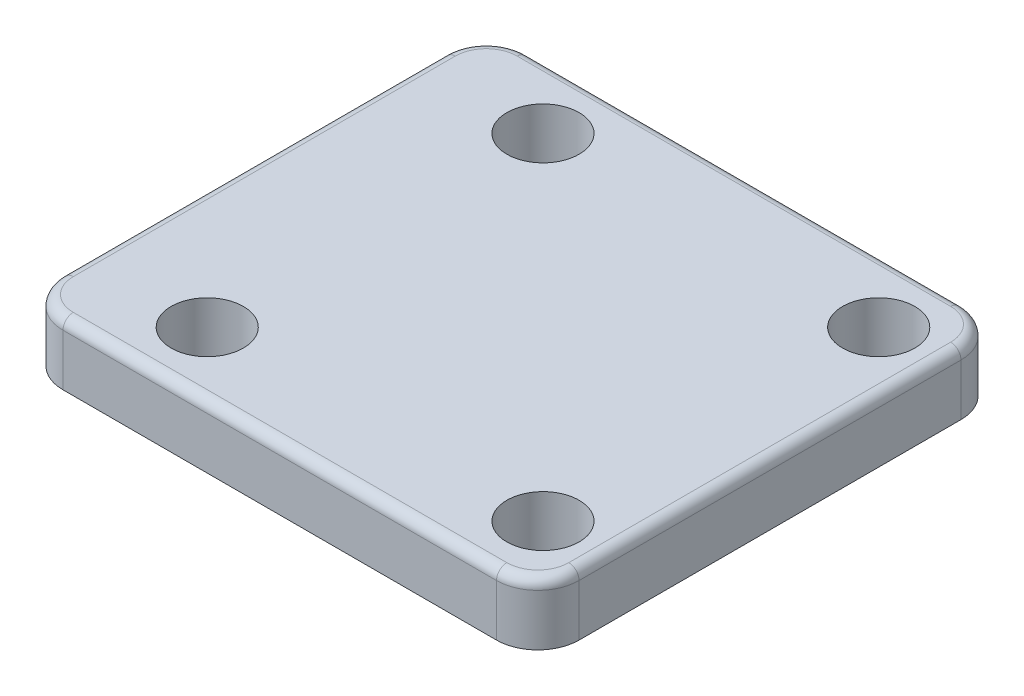
from build123d import *

# Parameters (mm, degrees)
BOSS_EXTRUDE1_DEPTH = 6
SKETCH3_R           = 3.5
CUT_EXTRUDE1_DEPTH  = 37.417715469
FILLET3_R           = 1
SKETCH4_R           = 16
BOSS_EXTRUDE2_DEPTH = 2
CHAMFER1_SIZE       = 1


with BuildPart() as part:
    # Sketch1 → Boss-Extrude1 (new body)
    with BuildSketch(Plane(origin=(0, 0, 0), x_dir=(1, 0, 0), z_dir=(0, 1, 0))):
        with BuildLine():
            Line((18, 22.5), (-24, 22.5))
            ThreePointArc((-24, 22.5), (-26.828427125, 21.328427125), (-28, 18.5))
            Line((-28, 18.5), (-28, -18.5))
            ThreePointArc((-28, -18.5), (-26.828427125, -21.328427125), (-24, -22.5))
            Line((-24, -22.5), (18, -22.5))
            ThreePointArc((18, -22.5), (20.828427125, -21.328427125), (22, -18.5))
            Line((22, -18.5), (22, 18.5))
            ThreePointArc((22, 18.5), (20.828427125, 21.328427125), (18, 22.5))
        make_face()
    extrude(amount=BOSS_EXTRUDE1_DEPTH)

    # Sketch3 → Cut-Extrude1 (cut, through all)
    with BuildSketch(Plane(origin=(0, 6, 0), x_dir=(1, 0, 0), z_dir=(0, 1, 0))):
        with Locations(Location((16.263455967, 16.263455967, 0), (0, 0, 270))):
            Circle(SKETCH3_R)
        with Locations(Location((16.263455967, -16.263455967, 0), (0, 0, 270))):
            Circle(SKETCH3_R)
        with Locations(Location((-16.263455967, -16.263455967, 0), (0, 0, 270))):
            Circle(SKETCH3_R)
        with Locations(Location((-16.263455967, 16.263455967, 0), (0, 0, 270))):
            Circle(SKETCH3_R)
    extrude(amount=-CUT_EXTRUDE1_DEPTH, mode=Mode.SUBTRACT)

    # Fillet3
    fillet3_edges = [part.edges().sort_by_distance(p)[0] for p in [
        (20.828427125, 6, 21.328427125),
        (22, 6, 0),
        (20.828427125, 6, -21.328427125),
        (-3, 6, -22.5),
        (-26.828427125, 6, -21.328427125),
        (-28, 6, 0),
        (-26.828427125, 6, 21.328427125),
        (-3, 6, 22.5),
    ]]
    fillet(fillet3_edges, radius=FILLET3_R)

    # Sketch4 → Boss-Extrude2 (add)
    with BuildSketch(Plane(origin=(0, 0, 0), x_dir=(-1, 0, 0), z_dir=(0, -1, 0))):
        with Locations(Location((0, 0, 0), (0, 0, 90))):
            Circle(SKETCH4_R)
    extrude(amount=BOSS_EXTRUDE2_DEPTH)

    # Chamfer1
    chamfer1_edges = [part.edges().sort_by_distance(p)[0] for p in [
        (0, -2, 16),
    ]]
    chamfer(chamfer1_edges, length=CHAMFER1_SIZE)


solid = part.part
